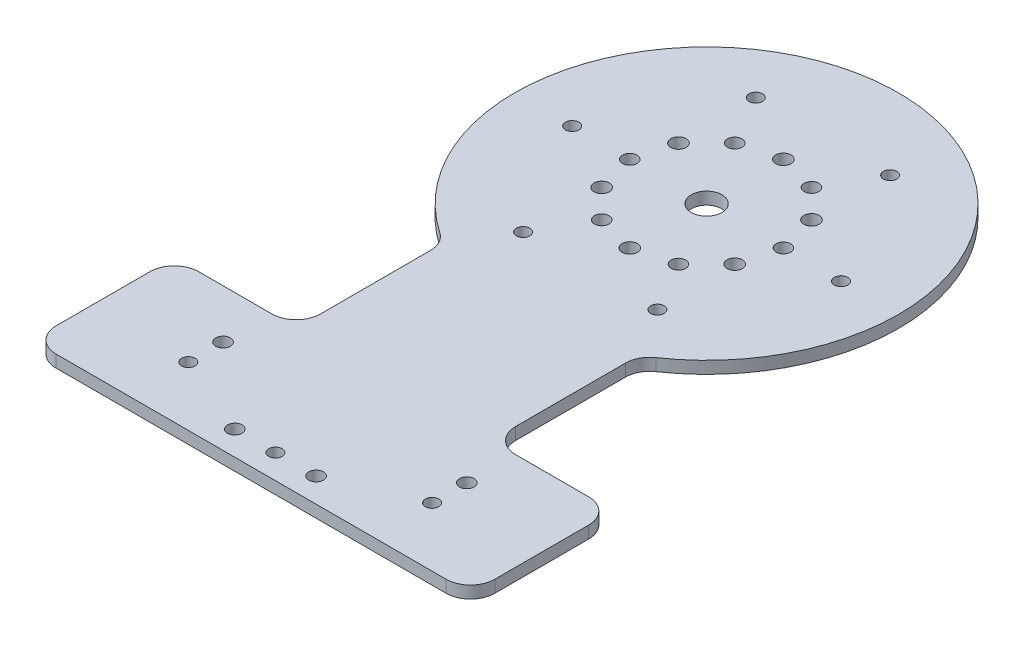
from build123d import *

# Parameters (mm, degrees)
SKETCH1_W           = 300
SKETCH1_H           = 200
BOSS_EXTRUDE1_DEPTH = 3.175
SKETCH6_R           = 4
CUT_EXTRUDE2_DEPTH  = 361.569106587
FILLET1_R           = 6.35
SKETCH2_R           = 1.5
CUT_EXTRUDE1_DEPTH  = 361.569106587
SKETCH16_R          = 1.89865
M5_THROUGH_DEPTH    = 358.384555661
SKETCH9_R           = 1.75
SKETCH9_R_2         = 1.89865
CUT_EXTRUDE3_DEPTH  = 361.569106587
SKETCH10_R          = 1.89865
SKETCH10_R_2        = 1.9939
CUT_EXTRUDE5_DEPTH  = 361.569106587
SKETCH17_R          = 1.75
M3_THROUGH_DEPTH    = 268.141091796
FILLET2_R           = 6.35


with BuildPart() as part:
    # Sketch1 → Boss-Extrude1 (new body)
    with BuildSketch(Plane(origin=(0, 0, 0), x_dir=(1, 0, 0), z_dir=(0, 1, 0))):
        with Locations((150, 100)):
            Rectangle(SKETCH1_W, SKETCH1_H)
    extrude(amount=BOSS_EXTRUDE1_DEPTH)

    # Sketch6 → Cut-Extrude2 (cut, through all)
    with BuildSketch(Plane(origin=(0, 3.175, 0), x_dir=(1, 0, 0), z_dir=(0, 1, 0))):
        with Locations(Location((150, 118.651, 0), (0, 0, 270))):
            Circle(SKETCH6_R)
    extrude(amount=-CUT_EXTRUDE2_DEPTH, mode=Mode.SUBTRACT)

    # Fillet1
    fillet1_edges = [part.edges().sort_by_distance(p)[0] for p in [
        (0, 1.5875, -200),
        (300, 1.5875, -200),
        (300, 1.5875, 0),
        (0, 1.5875, 0),
    ]]
    fillet(fillet1_edges, radius=FILLET1_R)

    # Sketch2 → Cut-Extrude1 (cut, through all)
    with BuildSketch(Plane(origin=(0, 3.175, 0), x_dir=(1, 0, 0), z_dir=(0, 1, 0))):
        with Locations(Location((6.35, 174.6, 0), (0, 0, 270))):
            Circle(SKETCH2_R)
        with Locations(Location((6.35, 49.9999, 0), (0, 0, 270))):
            Circle(SKETCH2_R)
        with Locations(Location((249.2, 75.3999, 0), (0, 0, 90))):
            Circle(SKETCH2_R)
        with Locations(Location((50.8, 75.3999, 0), (0, 0, 270))):
            Circle(SKETCH2_R)
        with Locations(Location((293.65, 49.9999, 0), (0, 0, 90))):
            Circle(SKETCH2_R)
        with Locations(Location((50.8, 24.5999, 0), (0, 0, 90))):
            Circle(SKETCH2_R)
        with Locations(Location((249.2, 24.5999, 0), (0, 0, 270))):
            Circle(SKETCH2_R)
        with Locations(Location((25.4, 193.65, 0), (0, 0, 270))):
            Circle(SKETCH2_R)
        with Locations(Location((274.6, 193.65, 0), (0, 0, 90))):
            Circle(SKETCH2_R)
        with Locations(Location((293.65, 174.6, 0), (0, 0, 90))):
            Circle(SKETCH2_R)
    extrude(amount=-CUT_EXTRUDE1_DEPTH, mode=Mode.SUBTRACT)

    # Sketch16 → M5_through (cut, through all)
    with BuildSketch(Plane(origin=(0, 3.175, -5.8), x_dir=(1, 0, 0), z_dir=(0, -1, 0))):
        with Locations(Location((118.25, -18.651, 0), (0, 0, 90))):
            Circle(SKETCH16_R)
        with Locations(Location((139.416666667, -0.55096, 0), (0, 0, 90))):
            Circle(SKETCH16_R)
        with Locations(Location((160.583333333, -0.55096, 0), (0, 0, 90))):
            Circle(SKETCH16_R)
        with Locations(Location((181.75, -18.651, 0), (0, 0, 90))):
            Circle(SKETCH16_R)
    extrude(amount=M5_THROUGH_DEPTH, mode=Mode.SUBTRACT)

    # Sketch9 → Cut-Extrude3 (cut, through all)
    with BuildSketch(Plane(origin=(0, 3.175, 0), x_dir=(-1, 0, 0), z_dir=(0, 1, 0))):
        with Locations(Location((-118.25, -15.40098, 0), (0, 0, 90))):
            Circle(SKETCH9_R)
        with Locations(Location((-150, -6.35096, 0), (0, 0, 90))):
            Circle(SKETCH9_R)
        with Locations(Location((-181.75, -15.40098, 0), (0, 0, 90))):
            Circle(SKETCH9_R)
        with Locations(Location((-160.583333333, -6.35096, 0), (0, 0, 90))):
            Circle(SKETCH9_R_2)
    extrude(amount=-CUT_EXTRUDE3_DEPTH, mode=Mode.SUBTRACT)

    # Sketch10 → Cut-Extrude5 (cut, through all)
    with BuildSketch(Plane(origin=(0, 3.175, 0), x_dir=(1, 0, 0), z_dir=(0, 1, 0))):
        with Locations(Location((160, 135.971508076, 0), (0, 0, 270))):
            Circle(SKETCH10_R)
        with Locations(Location((150, 138.651, 0), (0, 0, 270))):
            Circle(SKETCH10_R_2)
        with Locations(Location((167.320508076, 128.651, 0), (0, 0, 270))):
            Circle(SKETCH10_R_2)
        with Locations(Location((167.320508076, 108.651, 0), (0, 0, 270))):
            Circle(SKETCH10_R_2)
        with Locations(Location((150, 98.651, 0), (0, 0, 270))):
            Circle(SKETCH10_R_2)
        with Locations(Location((132.679491924, 108.651, 0), (0, 0, 270))):
            Circle(SKETCH10_R_2)
        with Locations(Location((132.679491924, 128.651, 0), (0, 0, 270))):
            Circle(SKETCH10_R_2)
        with Locations(Location((170, 118.651, 0), (0, 0, 270))):
            Circle(SKETCH10_R)
        with Locations(Location((160, 101.330491924, 0), (0, 0, 270))):
            Circle(SKETCH10_R)
        with Locations(Location((140, 101.330491924, 0), (0, 0, 270))):
            Circle(SKETCH10_R)
        with Locations(Location((130, 118.651, 0), (0, 0, 270))):
            Circle(SKETCH10_R)
        with Locations(Location((140, 135.971508076, 0), (0, 0, 270))):
            Circle(SKETCH10_R)
        with BuildLine():
            Line((124.6, 75.583146559), (124.6, 37.151))
            Line((124.6, 37.151), (92.85, 37.151))
            Line((92.85, 37.151), (92.85, 0))
            Line((92.85, 0), (0, 0))
            Line((0, 0), (0, 200))
            Line((0, 200), (300, 200))
            Line((300, 200), (300, 0))
            Line((300, 0), (207.15, 0))
            Line((207.15, 0), (207.15, 37.151))
            Line((207.15, 37.151), (175.4, 37.151))
            Line((175.4, 37.151), (175.4, 75.583146559))
            ThreePointArc((175.4, 75.583146559), (150, 168.651), (124.6, 75.583146559))
        make_face()
    extrude(amount=-CUT_EXTRUDE5_DEPTH, mode=Mode.SUBTRACT)

    # Sketch17 → M3-through (cut, through all)
    with BuildSketch(Plane(origin=(0, 3.175, 0), x_dir=(1, 0, 0), z_dir=(0, 1, 0))):
        with Locations(Location((185, 118.651, 0), (0, 0, 270))):
            Circle(SKETCH17_R)
        with Locations(Location((167.5, 88.340110868, 0), (0, 0, 270))):
            Circle(SKETCH17_R)
        with Locations(Location((132.5, 88.340110868, 0), (0, 0, 270))):
            Circle(SKETCH17_R)
        with Locations(Location((115, 118.651, 0), (0, 0, 270))):
            Circle(SKETCH17_R)
        with Locations(Location((132.5, 148.961889132, 0), (0, 0, 270))):
            Circle(SKETCH17_R)
        with Locations(Location((167.5, 148.961889132, 0), (0, 0, 270))):
            Circle(SKETCH17_R)
    extrude(amount=-M3_THROUGH_DEPTH, mode=Mode.SUBTRACT)

    # Fillet2
    fillet2_edges = [part.edges().sort_by_distance(p)[0] for p in [
        (175.4, 1.5875, -75.583146559),
        (124.6, 1.5875, -75.583146559),
        (124.6, 1.5875, -37.151),
        (92.85, 1.5875, -37.151),
        (92.85, 1.5875, 0),
        (207.15, 1.5875, 0),
        (207.15, 1.5875, -37.151),
        (175.4, 1.5875, -37.151),
    ]]
    fillet(fillet2_edges, radius=FILLET2_R)


solid = part.part
